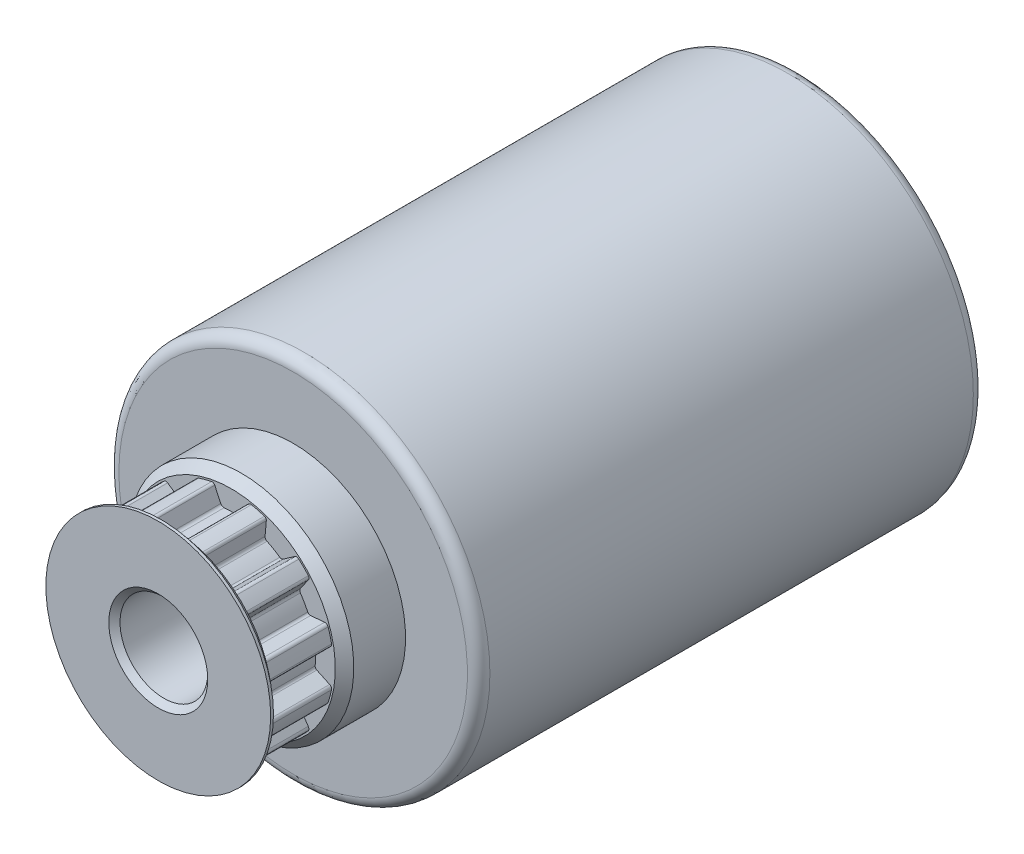
from build123d import *

# Parameters (mm, degrees)
EXTRUDE_1_DEPTH             = 5.5
SKETCH_2_R                  = 20
EXTRUDE_2_DEPTH             = 2
CHAMFER_1_SIZE              = 1.5
CHAMFER_1_SIZE2             = 1.787630389
CHAMFER_1_OF_MIRROR_1_SIZE2 = 1.5
CHAMFER_1_OF_MIRROR_1_SIZE  = 1.787630389
SKETCH_3_R                  = 3.4
CUT_EXTRUDE_1_DEPTH         = 30
SKETCH_8_R                  = 20
EXTRUDE_3_DEPTH             = 9
SKETCH_11_R                 = 33
EXTRUDE_4_DEPTH             = 90
SKETCH_10_R                 = 7.8
CUT_EXTRUDE_2_DEPTH         = 191
CHAMFER_2_SIZE              = 1
FILLET_1_R                  = 2


with BuildPart() as part:
    # 스케치1 → 보스-돌출1 (new, symmetric)
    with BuildSketch(Plane.XY):
        with BuildLine():
            Line((12.279067203, 9.260056493), (13.72951471, 11.331510209))
            ThreePointArc((13.72951471, 11.331510209), (13.819231237, 11.644886966), (13.696740348, 11.946963163))
            ThreePointArc((13.696740348, 11.946963163), (12.880233507, 12.823034344), (12.007805037, 13.643432236))
            ThreePointArc((12.007805037, 13.643432236), (11.644638313, 13.792108644), (11.267252957, 13.684521298))
            Line((11.267252957, 13.684521298), (9.202645163, 12.238867358))
            ThreePointArc((9.202645163, 12.238867358), (8.915071795, 12.148443996), (8.627783828, 12.239770064))
            ThreePointArc((8.627783828, 12.239770064), (7.516754209, 12.951796446), (6.347354905, 13.563248531))
            ThreePointArc((6.347354905, 13.563248531), (6.081851507, 13.807041329), (6.003955886, 14.158977765))
            Line((6.003955886, 14.158977765), (6.224353416, 16.678133059))
            ThreePointArc((6.224353416, 16.678133059), (6.145361829, 16.994383555), (5.888243509, 17.194743772))
            ThreePointArc((5.888243509, 17.194743772), (4.743092252, 17.54519025), (3.577348088, 17.81946143))
            ThreePointArc((3.577348088, 17.81946143), (3.188498275, 17.766635614), (2.915466643, 17.484769561))
            Line((2.915466643, 17.484769561), (1.850290815, 15.200492627))
            ThreePointArc((1.850290815, 15.200492627), (1.646456756, 14.978397074), (1.351995179, 14.913843704))
            ThreePointArc((1.351995179, 14.913843704), (0.033801995, 14.974961851), (-1.284653671, 14.919795238))
            ThreePointArc((-1.284653671, 14.919795238), (-1.636482757, 14.998174295), (-1.879910562, 15.26401238))
            Line((-1.879910562, 15.26401238), (-2.948618349, 17.555863625))
            ThreePointArc((-2.948618349, 17.555863625), (-3.175152318, 17.790248795), (-3.498003423, 17.835206672))
            ThreePointArc((-3.498003423, 17.835206672), (-4.664956742, 17.566126596), (-5.811656393, 17.220780324))
            ThreePointArc((-5.811656393, 17.220780324), (-6.121997301, 16.980606919), (-6.217516604, 16.599987941))
            Line((-6.217516604, 16.599987941), (-5.997847464, 14.089158172))
            ThreePointArc((-5.997847464, 14.089158172), (-6.06332522, 13.794900649), (-6.286059898, 13.591765005))
            ThreePointArc((-6.286059898, 13.591765005), (-7.458207642, 12.985598321), (-8.572440333, 12.27859486))
            ThreePointArc((-8.572440333, 12.27859486), (-8.916322788, 12.170558572), (-9.260056493, 12.279067203))
            Line((-9.260056493, 12.279067203), (-11.331510209, 13.72951471))
            ThreePointArc((-11.331510209, 13.72951471), (-11.644886966, 13.819231237), (-11.946963163, 13.696740348))
            ThreePointArc((-11.946963163, 13.696740348), (-12.823034344, 12.880233507), (-13.643432236, 12.007805037))
            ThreePointArc((-13.643432236, 12.007805037), (-13.792108644, 11.644638313), (-13.684521298, 11.267252957))
            Line((-13.684521298, 11.267252957), (-12.238867358, 9.202645163))
            ThreePointArc((-12.238867358, 9.202645163), (-12.148443996, 8.915071795), (-12.239770064, 8.627783828))
            ThreePointArc((-12.239770064, 8.627783828), (-12.951796446, 7.516754209), (-13.563248531, 6.347354905))
            ThreePointArc((-13.563248531, 6.347354905), (-13.807041329, 6.081851507), (-14.158977765, 6.003955886))
            Line((-14.158977765, 6.003955886), (-16.678133059, 6.224353416))
            ThreePointArc((-16.678133059, 6.224353416), (-16.994383555, 6.145361829), (-17.194743772, 5.888243509))
            ThreePointArc((-17.194743772, 5.888243509), (-17.54519025, 4.743092252), (-17.81946143, 3.577348088))
            ThreePointArc((-17.81946143, 3.577348088), (-17.766635614, 3.188498275), (-17.484769561, 2.915466643))
            Line((-17.484769561, 2.915466643), (-15.200492627, 1.850290815))
            ThreePointArc((-15.200492627, 1.850290815), (-14.978397015, 1.646456653), (-14.913843726, 1.351994942))
            ThreePointArc((-14.913843726, 1.351994942), (-14.974961851, 0.033801876), (-14.919795238, -1.284653671))
            ThreePointArc((-14.919795238, -1.284653671), (-14.998174295, -1.636482757), (-15.26401238, -1.879910562))
            Line((-15.26401238, -1.879910562), (-17.555863625, -2.948618349))
            ThreePointArc((-17.555863625, -2.948618349), (-17.790248795, -3.175152318), (-17.835206672, -3.498003423))
            ThreePointArc((-17.835206672, -3.498003423), (-17.566126596, -4.664956742), (-17.220780324, -5.811656393))
            ThreePointArc((-17.220780324, -5.811656393), (-16.980606919, -6.121997301), (-16.599987941, -6.217516604))
            Line((-16.599987941, -6.217516604), (-14.089158172, -5.997847464))
            ThreePointArc((-14.089158172, -5.997847464), (-13.794900649, -6.06332522), (-13.591765005, -6.286059898))
            ThreePointArc((-13.591765005, -6.286059898), (-12.985598321, -7.458207642), (-12.27859486, -8.572440333))
            ThreePointArc((-12.27859486, -8.572440333), (-12.170558572, -8.916322788), (-12.279067203, -9.260056493))
            Line((-12.279067203, -9.260056493), (-13.72951471, -11.331510209))
            ThreePointArc((-13.72951471, -11.331510209), (-13.819231237, -11.644886966), (-13.696740348, -11.946963163))
            ThreePointArc((-13.696740348, -11.946963163), (-12.880233507, -12.823034344), (-12.007805037, -13.643432236))
            ThreePointArc((-12.007805037, -13.643432236), (-11.644638313, -13.792108644), (-11.267252957, -13.684521298))
            Line((-11.267252957, -13.684521298), (-9.202645163, -12.238867358))
            ThreePointArc((-9.202645163, -12.238867358), (-8.915071795, -12.148443996), (-8.627783828, -12.239770064))
            ThreePointArc((-8.627783828, -12.239770064), (-7.516754209, -12.951796446), (-6.347354905, -13.563248531))
            ThreePointArc((-6.347354905, -13.563248531), (-6.081851507, -13.807041329), (-6.003955886, -14.158977765))
            Line((-6.003955886, -14.158977765), (-6.224353416, -16.678133059))
            ThreePointArc((-6.224353416, -16.678133059), (-6.145361829, -16.994383555), (-5.888243509, -17.194743772))
            ThreePointArc((-5.888243509, -17.194743772), (-4.743092252, -17.54519025), (-3.577348088, -17.81946143))
            ThreePointArc((-3.577348088, -17.81946143), (-3.188498275, -17.766635614), (-2.915466643, -17.484769561))
            Line((-2.915466643, -17.484769561), (-1.850290815, -15.200492627))
            ThreePointArc((-1.850290815, -15.200492627), (-1.646456653, -14.978397015), (-1.351994942, -14.913843726))
            ThreePointArc((-1.351994942, -14.913843726), (-0.033801876, -14.974961851), (1.284653671, -14.919795238))
            ThreePointArc((1.284653671, -14.919795238), (1.636482757, -14.998174295), (1.879910562, -15.26401238))
            Line((1.879910562, -15.26401238), (2.948618349, -17.555863625))
            ThreePointArc((2.948618349, -17.555863625), (3.175152318, -17.790248795), (3.498003423, -17.835206672))
            ThreePointArc((3.498003423, -17.835206672), (4.664956742, -17.566126596), (5.811656393, -17.220780324))
            ThreePointArc((5.811656393, -17.220780324), (6.121997301, -16.980606919), (6.217516604, -16.599987941))
            Line((6.217516604, -16.599987941), (5.997847464, -14.089158172))
            ThreePointArc((5.997847464, -14.089158172), (6.06332522, -13.794900649), (6.286059898, -13.591765005))
            ThreePointArc((6.286059898, -13.591765005), (7.458207642, -12.985598321), (8.572440333, -12.27859486))
            ThreePointArc((8.572440333, -12.27859486), (8.916322788, -12.170558572), (9.260056493, -12.279067203))
            Line((9.260056493, -12.279067203), (11.331510209, -13.72951471))
            ThreePointArc((11.331510209, -13.72951471), (11.644886966, -13.819231237), (11.946963163, -13.696740348))
            ThreePointArc((11.946963163, -13.696740348), (12.823034344, -12.880233507), (13.643432236, -12.007805037))
            ThreePointArc((13.643432236, -12.007805037), (13.792108644, -11.644638313), (13.684521298, -11.267252957))
            Line((13.684521298, -11.267252957), (12.238867358, -9.202645163))
            ThreePointArc((12.238867358, -9.202645163), (12.148443996, -8.915071914), (12.239769926, -8.627784023))
            ThreePointArc((12.239769926, -8.627784023), (12.951796386, -7.516754312), (13.563248531, -6.347354905))
            ThreePointArc((13.563248531, -6.347354905), (13.807041329, -6.081851507), (14.158977765, -6.003955886))
            Line((14.158977765, -6.003955886), (16.678133059, -6.224353416))
            ThreePointArc((16.678133059, -6.224353416), (16.994383555, -6.145361829), (17.194743772, -5.888243509))
            ThreePointArc((17.194743772, -5.888243509), (17.54519025, -4.743092252), (17.81946143, -3.577348088))
            ThreePointArc((17.81946143, -3.577348088), (17.766635614, -3.188498275), (17.484769561, -2.915466643))
            Line((17.484769561, -2.915466643), (15.200492627, -1.850290815))
            ThreePointArc((15.200492627, -1.850290815), (14.978397015, -1.646456653), (14.913843726, -1.351994942))
            ThreePointArc((14.913843726, -1.351994942), (14.974961851, -0.033801876), (14.919795238, 1.284653671))
            ThreePointArc((14.919795238, 1.284653671), (14.998174295, 1.636482757), (15.26401238, 1.879910562))
            Line((15.26401238, 1.879910562), (17.555863625, 2.948618349))
            ThreePointArc((17.555863625, 2.948618349), (17.790248795, 3.175152318), (17.835206672, 3.498003423))
            ThreePointArc((17.835206672, 3.498003423), (17.566126596, 4.664956742), (17.220780324, 5.811656393))
            ThreePointArc((17.220780324, 5.811656393), (16.980606919, 6.121997301), (16.599987941, 6.217516604))
            Line((16.599987941, 6.217516604), (14.089158172, 5.997847464))
            ThreePointArc((14.089158172, 5.997847464), (13.794900649, 6.06332522), (13.591765005, 6.286059898))
            ThreePointArc((13.591765005, 6.286059898), (12.985598253, 7.458207762), (12.278594702, 8.572440559))
            ThreePointArc((12.278594702, 8.572440559), (12.170558572, 8.916322926), (12.279067203, 9.260056493))
        make_face()
    extrude(amount=EXTRUDE_1_DEPTH, both=True)

    # 스케치2 → 보스-돌출2 (add)
    with BuildSketch(Plane.XY.offset(5.5)):
        Circle(SKETCH_2_R)
    extrude_2 = extrude(amount=EXTRUDE_2_DEPTH)

    # 모따기1
    chamfer_1_edges = [part.edges().sort_by_distance(p)[0] for p in [
        (-20, 0, 5.5),
    ]]
    chamfer_1_side = [part.faces().sort_by_distance(p)[0] for p in [
        (-20, 0, 6.5),
    ]]
    chamfer(chamfer_1_edges, length=CHAMFER_1_SIZE, length2=CHAMFER_1_SIZE2, reference=chamfer_1_side[0])

    # 대칭 복사1: 보스-돌출2 across plane
    add(extrude_2.mirror(Plane.XY))

    # 모따기1 of 대칭 복사1
    chamfer_1_of_mirror_1_edges = [part.edges().sort_by_distance(p)[0] for p in [
        (-20, 0, -5.5),
    ]]
    chamfer(chamfer_1_of_mirror_1_edges, length=CHAMFER_1_OF_MIRROR_1_SIZE, length2=CHAMFER_1_OF_MIRROR_1_SIZE2)

    # 스케치3 → 컷-돌출1 (cut)
    with BuildSketch(Plane(origin=(0, 0, -7.5), x_dir=(-1, 0, 0), z_dir=(0, 0, -1))):
        Circle(SKETCH_3_R)
    extrude(amount=-CUT_EXTRUDE_1_DEPTH, mode=Mode.SUBTRACT)

    # 스케치8 → 보스-돌출3 (add)
    with BuildSketch(Plane(origin=(0, 0, -7.5), x_dir=(-1, 0, 0), z_dir=(0, 0, -1))):
        with Locations(Location((0, 0, 0), (0, 0, 180))):
            Circle(SKETCH_8_R)
    extrude(amount=EXTRUDE_3_DEPTH)

    # 스케치11 → 보스-돌출4 (add)
    with BuildSketch(Plane(origin=(0, 0, -16.5), x_dir=(-1, 0, 0), z_dir=(0, 0, -1))):
        with Locations(Location((0, 0, 0), (0, 0, 180))):
            Circle(SKETCH_11_R)
    extrude(amount=EXTRUDE_4_DEPTH)

    # 스케치10 → 컷-돌출2 (cut)
    with BuildSketch(Plane.XY.offset(7.5)):
        Circle(SKETCH_10_R)
    extrude(amount=-CUT_EXTRUDE_2_DEPTH, mode=Mode.SUBTRACT)

    # 모따기2
    chamfer_2_edges = [part.edges().sort_by_distance(p)[0] for p in [
        (-7.8, 0, 7.5),
        (-7.8, 0, -106.5),
    ]]
    chamfer(chamfer_2_edges, length=CHAMFER_2_SIZE)

    # 필렛1
    fillet_1_edges = [part.edges().sort_by_distance(p)[0] for p in [
        (-33, 0, -16.5),
        (-33, 0, -106.5),
    ]]
    fillet(fillet_1_edges, radius=FILLET_1_R)


solid = part.part
